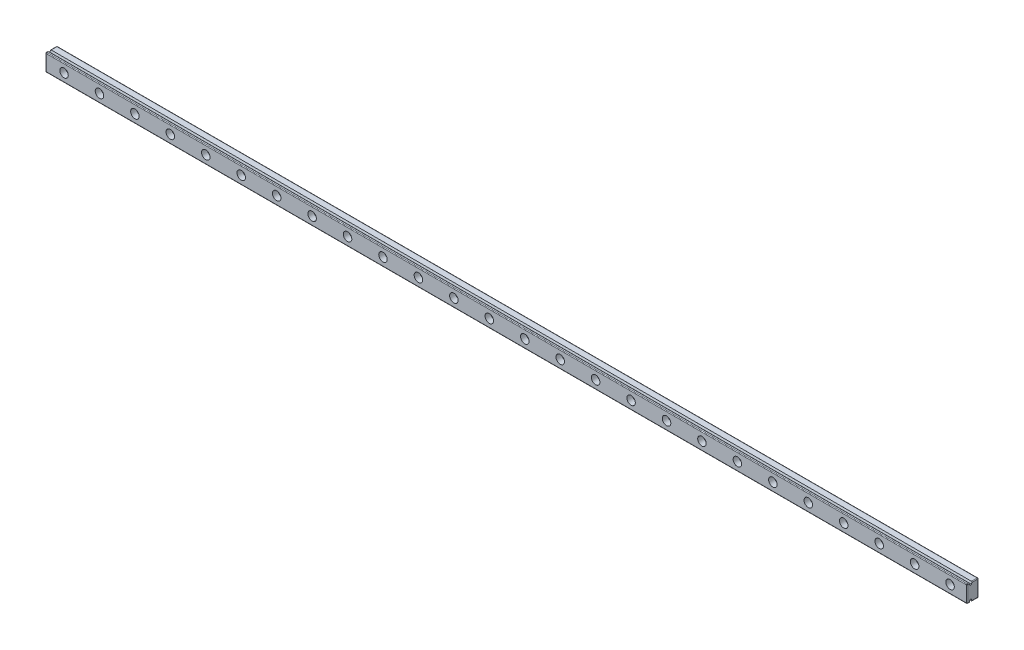
from build123d import *
from OCP.BRepFilletAPI import BRepFilletAPI_MakeChamfer

# Parameters (mm, degrees)
BOSS_EXTRUDE1_DEPTH = 650
SKETCH2_R           = 1.75
CUT_EXTRUDE1_DEPTH  = 10
SKETCH3_R           = 3
CUT_EXTRUDE2_DEPTH  = 4
CHAMFER1_SIZE       = 0.5
CHAMFER1_SIZE2      = 1.743707222
FILLET1_R           = 0.5


with BuildPart() as part:
    # Sketch1 → Boss-Extrude1 (new body)
    with BuildSketch(Plane(origin=(0, 0, 0), x_dir=(0, 0, -1), z_dir=(1, 0, 0))):
        Polygon((-0.5, 6), (4, 6), (4, -6), (-0.5, -6), (-0.5, -4.25), (-2.5, -4.25), (-2.5, -6), (-4, -6), (-4, 6), (-2.5, 6), (-2.5, 4.25), (-0.5, 4.25), align=None)
    extrude(amount=BOSS_EXTRUDE1_DEPTH)

    # Sketch2 → Cut-Extrude1 (cut)
    with BuildSketch(Plane.XY.offset(4)):
        with Locations((13, 0)):
            Circle(SKETCH2_R)
        with Locations((38, 0)):
            Circle(SKETCH2_R)
        with Locations((63, 0)):
            Circle(SKETCH2_R)
        with Locations((88, 0)):
            Circle(SKETCH2_R)
        with Locations((113, 0)):
            Circle(SKETCH2_R)
        with Locations((138, 0)):
            Circle(SKETCH2_R)
        with Locations((163, 0)):
            Circle(SKETCH2_R)
        with Locations((188, 0)):
            Circle(SKETCH2_R)
        with Locations((213, 0)):
            Circle(SKETCH2_R)
        with Locations((238, 0)):
            Circle(SKETCH2_R)
        with Locations((263, 0)):
            Circle(SKETCH2_R)
        with Locations((288, 0)):
            Circle(SKETCH2_R)
        with Locations((313, 0)):
            Circle(SKETCH2_R)
        with Locations((338, 0)):
            Circle(SKETCH2_R)
        with Locations((363, 0)):
            Circle(SKETCH2_R)
        with Locations((388, 0)):
            Circle(SKETCH2_R)
        with Locations((413, 0)):
            Circle(SKETCH2_R)
        with Locations((438, 0)):
            Circle(SKETCH2_R)
        with Locations((463, 0)):
            Circle(SKETCH2_R)
        with Locations((488, 0)):
            Circle(SKETCH2_R)
        with Locations((513, 0)):
            Circle(SKETCH2_R)
        with Locations((538, 0)):
            Circle(SKETCH2_R)
        with Locations((563, 0)):
            Circle(SKETCH2_R)
        with Locations((588, 0)):
            Circle(SKETCH2_R)
        with Locations((613, 0)):
            Circle(SKETCH2_R)
        with Locations((638, 0)):
            Circle(SKETCH2_R)
    extrude(amount=-CUT_EXTRUDE1_DEPTH, mode=Mode.SUBTRACT)

    # Sketch3 → Cut-Extrude2 (cut)
    with BuildSketch(Plane.XY.offset(4)):
        with Locations((13, 0)):
            Circle(SKETCH3_R)
        with Locations((38, 0)):
            Circle(SKETCH3_R)
        with Locations((63, 0)):
            Circle(SKETCH3_R)
        with Locations((88, 0)):
            Circle(SKETCH3_R)
        with Locations((113, 0)):
            Circle(SKETCH3_R)
        with Locations((138, 0)):
            Circle(SKETCH3_R)
        with Locations((163, 0)):
            Circle(SKETCH3_R)
        with Locations((188, 0)):
            Circle(SKETCH3_R)
        with Locations((213, 0)):
            Circle(SKETCH3_R)
        with Locations((238, 0)):
            Circle(SKETCH3_R)
        with Locations((263, 0)):
            Circle(SKETCH3_R)
        with Locations((288, 0)):
            Circle(SKETCH3_R)
        with Locations((313, 0)):
            Circle(SKETCH3_R)
        with Locations((338, 0)):
            Circle(SKETCH3_R)
        with Locations((363, 0)):
            Circle(SKETCH3_R)
        with Locations((388, 0)):
            Circle(SKETCH3_R)
        with Locations((413, 0)):
            Circle(SKETCH3_R)
        with Locations((438, 0)):
            Circle(SKETCH3_R)
        with Locations((463, 0)):
            Circle(SKETCH3_R)
        with Locations((488, 0)):
            Circle(SKETCH3_R)
        with Locations((513, 0)):
            Circle(SKETCH3_R)
        with Locations((538, 0)):
            Circle(SKETCH3_R)
        with Locations((563, 0)):
            Circle(SKETCH3_R)
        with Locations((588, 0)):
            Circle(SKETCH3_R)
        with Locations((613, 0)):
            Circle(SKETCH3_R)
        with Locations((638, 0)):
            Circle(SKETCH3_R)
    extrude(amount=-CUT_EXTRUDE2_DEPTH, mode=Mode.SUBTRACT)

    # Chamfer1: one chamfer whose edges measure the first distance from different faces: ONE call of the kernel's chamfer builder (chamfer() names one face for all edges)
    chamfer1_edges_1 = [part.edges().sort_by_distance(p)[0] for p in [
        (325, -4.25, 0.5),
        (325, -4.25, 2.5),
    ]]
    chamfer1_side_1 = [part.faces().sort_by_distance(p)[0] for p in [
        (325, -4.25, 1.5),
    ]]
    chamfer1_edges_2 = [part.edges().sort_by_distance(p)[0] for p in [
        (325, 4.25, 2.5),
        (325, 4.25, 0.5),
    ]]
    chamfer1_side_2 = [part.faces().sort_by_distance(p)[0] for p in [
        (325, 4.25, 1.5),
    ]]
    chamfer1 = BRepFilletAPI_MakeChamfer(part.part.solid().wrapped)
    for e in chamfer1_edges_1:
        chamfer1.Add(CHAMFER1_SIZE, CHAMFER1_SIZE2, e.wrapped, chamfer1_side_1[0].wrapped)  # the first distance lies on this face
    for e in chamfer1_edges_2:
        chamfer1.Add(CHAMFER1_SIZE, CHAMFER1_SIZE2, e.wrapped, chamfer1_side_2[0].wrapped)  # the first distance lies on this face
    add(Compound.cast(chamfer1.Shape()), mode=Mode.REPLACE)

    # Fillet1
    fillet1_edges = [part.edges().sort_by_distance(p)[0] for p in [
        (650, -6, -1.75),
        (650, 0, -4),
        (650, 6, -1.75),
        (650, 6, 3.25),
        (650, 0, 4),
        (650, -6, 3.25),
        (0, -6, 3.25),
        (0, -6, -1.75),
        (0, 0, -4),
        (0, 6, -1.75),
        (0, 6, 3.25),
        (0, 0, 4),
        (325, -4.25, 1),
        (325, -4.25, 2),
        (325, 4.25, 2),
        (325, 4.25, 1),
        (325, -6, 4),
        (325, 6, 4),
        (325, -6, -4),
        (325, 6, -4),
    ]]
    fillet(fillet1_edges, radius=FILLET1_R)


solid = part.part
